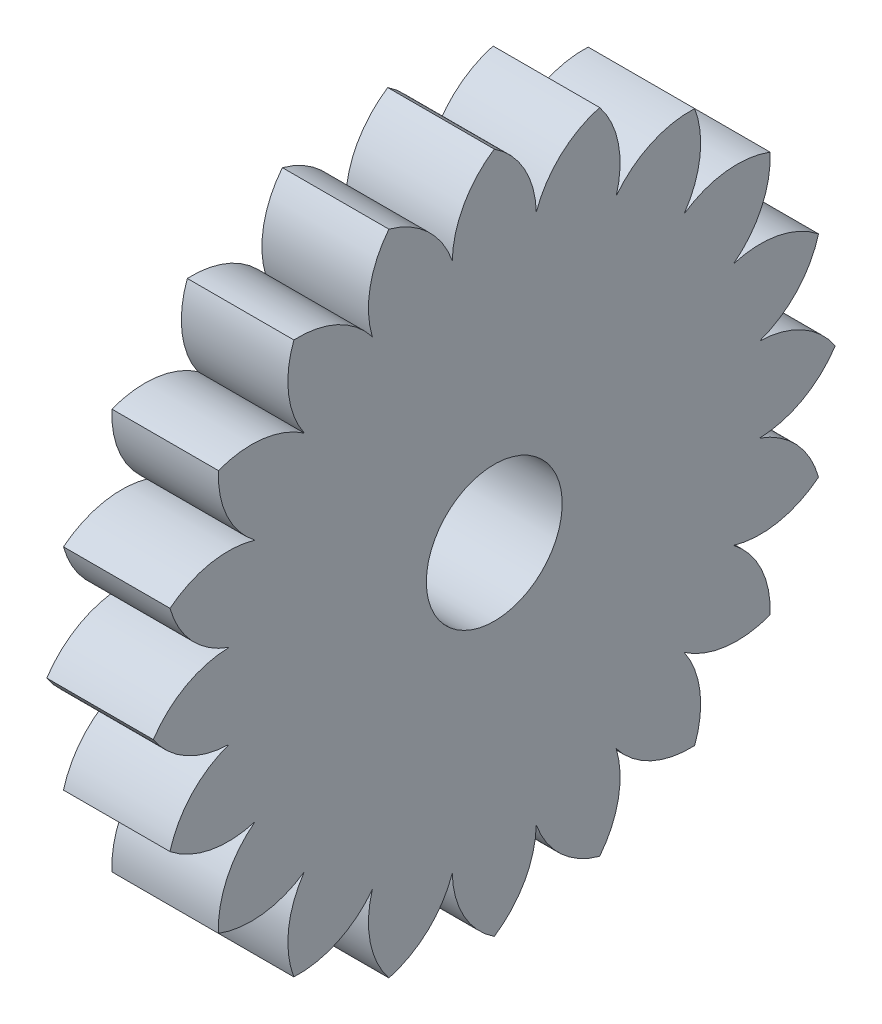
from build123d import *

# Parameters (mm, degrees)
EXTRUDE_1_DEPTH          = 4
PATTERN_CIRCULAR_1_COUNT = 20
CUT_EXTRUDE_1_DEPTH      = 19.538608362
CUT_EXTRUDE_1_DEPTH_BACK = 19.538608362
SKETCH_2_R               = 2.55


with BuildPart() as part:
    # 스케치1 → 보스-돌출1 (new body)
    with BuildSketch(Plane(origin=(0, 0, 0), x_dir=(0, 0, -1), z_dir=(1, 0, 0))):
        with BuildLine():
            ThreePointArc((0, 12.8), (1.158685544, 11.536663611), (1.578481404, 9.874633991))
            ThreePointArc((1.578481404, 9.874633991), (0, -10), (-1.578481404, 9.874633991))
            ThreePointArc((-1.578481404, 9.874633991), (-1.158685544, 11.536663611), (0, 12.8))
        make_face()
    extrude_1 = extrude(amount=EXTRUDE_1_DEPTH)

    # 원형 패턴1: 보스-돌출1 ×20 about axis
    pattern_circular_1_axis = Axis((0, 0, 0), (1, 0, 0))
    for i in range(1, PATTERN_CIRCULAR_1_COUNT):
        add(extrude_1.rotate(pattern_circular_1_axis, i * 360 / PATTERN_CIRCULAR_1_COUNT))

    # 스케치2 → 컷-돌출1 (cut, two sides: drawn at the far end of the back side and taken through both)
    with BuildSketch(Plane.ZY.offset(-CUT_EXTRUDE_1_DEPTH_BACK)):
        Circle(SKETCH_2_R)
    extrude(amount=CUT_EXTRUDE_1_DEPTH + CUT_EXTRUDE_1_DEPTH_BACK, mode=Mode.SUBTRACT)


solid = part.part
